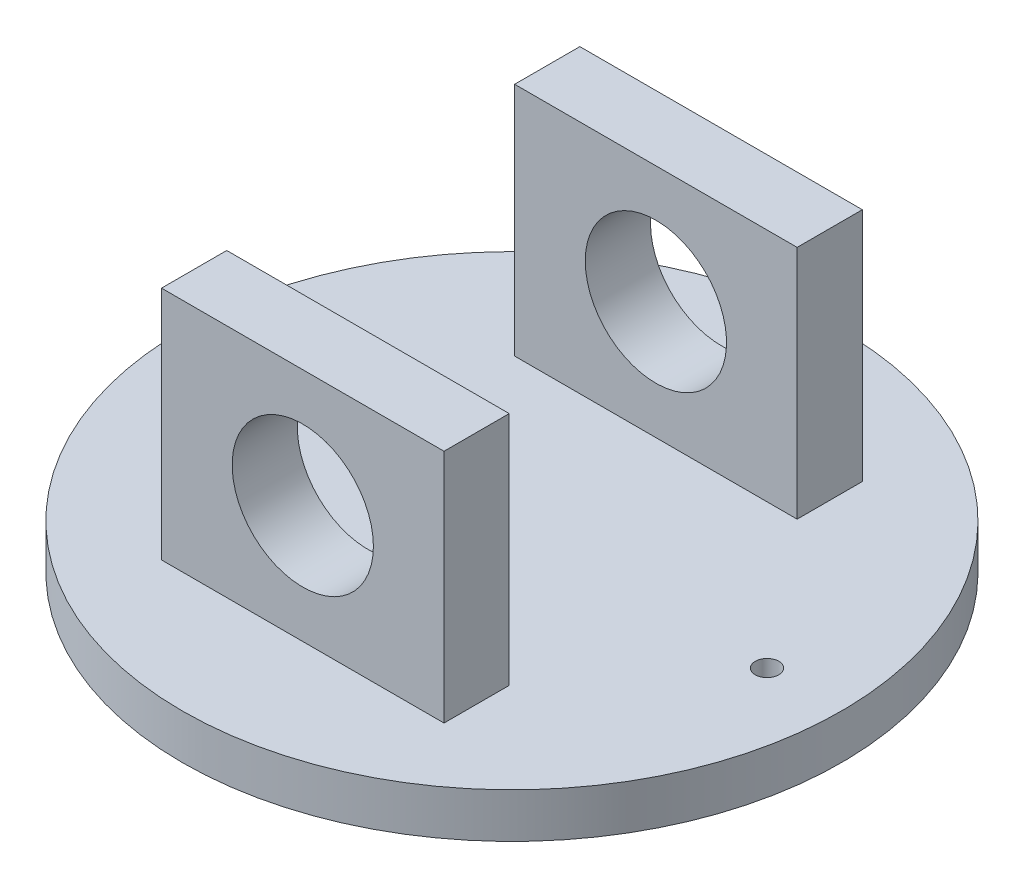
from build123d import *

# Parameters (mm, degrees)
SKETCH_4_R          = 2.5
EXTRUDE_3_DEPTH     = 25
SKETCH_5_R          = 7.5
EXTRUDE_4_DEPTH     = 25
SKETCH_6_R          = 139.999706489
EXTRUDE_5_DEPTH     = 19
SKETCH_15_W         = 120
SKETCH_15_H         = 27.7
EXTRUDE_7_DEPTH     = 100
CUT_EXTRUDE_3_REACH = 309.363
SKETCH_16_R         = 30
CUT_EXTRUDE_4_REACH = 309.363
SKETCH_17_R         = 30
SKETCH_18_R         = 2
EXTRUDE_8_DEPTH     = 30
SKETCH_19_R         = 5
CUT_EXTRUDE_5_DEPTH = 222.810359618


with BuildPart() as part:
    # 草图4 → 凸台-拉伸3 (new body)
    with BuildSketch(Plane(origin=(0, 0, 0), x_dir=(1, 0, 0), z_dir=(0, 1, 0))):
        with Locations(Location((0, 0, 0), (0, 0, 270))):
            Circle(SKETCH_4_R)
    extrude(amount=EXTRUDE_3_DEPTH)

    # 草图5 → 凸台-拉伸4 (add)
    with BuildSketch(Plane(origin=(0, 25, 0), x_dir=(1, 0, 0), z_dir=(0, 1, 0))):
        with Locations(Location((0, 0, 0), (0, 0, 270))):
            Circle(SKETCH_5_R)
    extrude(amount=EXTRUDE_4_DEPTH)

    # 草图6 → 凸台-拉伸5 (add)
    with BuildSketch(Plane(origin=(0, 50, 0), x_dir=(1, 0, 0), z_dir=(0, 1, 0))):
        with Locations(Location((0, 0, 0), (0, 0, 270))):
            Circle(SKETCH_6_R)
    extrude(amount=-EXTRUDE_5_DEPTH)

    # 草图15 → 凸台-拉伸7 (add)
    with BuildSketch(Plane(origin=(0, 50, 0), x_dir=(1, 0, 0), z_dir=(0, 1, 0))):
        with Locations((0, 75)):
            Rectangle(SKETCH_15_W, SKETCH_15_H)
        with Locations((0, -75)):
            Rectangle(SKETCH_15_W, SKETCH_15_H)
    extrude(amount=EXTRUDE_7_DEPTH)

    # 草图16 → 切除-拉伸3 (cut, up to next)
    with BuildSketch(Plane.XY.offset(88.85), mode=Mode.PRIVATE) as cut_extrude_3_sk1:
        with Locations((0, 100)):
            Circle(SKETCH_16_R)
    cut_extrude_3_tool1 = extrude(cut_extrude_3_sk1.sketch, amount=-CUT_EXTRUDE_3_REACH, mode=Mode.PRIVATE) & part.part
    add(cut_extrude_3_tool1.solids().sort_by_distance((0, 100, 88.85))[0], mode=Mode.SUBTRACT)

    # 草图17 → 切除-拉伸4 (cut, up to next)
    with BuildSketch(Plane(origin=(0, 0, -88.85), x_dir=(-1, 0, 0), z_dir=(0, 0, -1)), mode=Mode.PRIVATE) as cut_extrude_4_sk1:
        with Locations(Location((0, 100, 0), (0, 0, 180))):
            Circle(SKETCH_17_R)
    cut_extrude_4_tool1 = extrude(cut_extrude_4_sk1.sketch, amount=-CUT_EXTRUDE_4_REACH, mode=Mode.PRIVATE) & part.part
    add(cut_extrude_4_tool1.solids().sort_by_distance((0, 100, -88.85))[0], mode=Mode.SUBTRACT)

    # 草图18 → 凸台-拉伸8 (add)
    with BuildSketch(Plane.XZ.offset(-31)):
        with Locations(Location((0, 17.25, 0), (0, 0, 90))):
            Circle(SKETCH_18_R)
        with Locations(Location((14.938938215, 8.625, 0), (0, 0, 90))):
            Circle(SKETCH_18_R)
        with Locations(Location((14.938938215, -8.625, 0), (0, 0, 90))):
            Circle(SKETCH_18_R)
        with Locations(Location((0, -17.25, 0), (0, 0, 90))):
            Circle(SKETCH_18_R)
        with Locations(Location((-14.938938215, -8.625, 0), (0, 0, 90))):
            Circle(SKETCH_18_R)
        with Locations(Location((-14.938938215, 8.625, 0), (0, 0, 90))):
            Circle(SKETCH_18_R)
    extrude(amount=EXTRUDE_8_DEPTH)

    # 草图19 → 切除-拉伸5 (cut, symmetric)
    with BuildSketch(Plane(origin=(0, 50, 0), x_dir=(1, 0, 0), z_dir=(0, 1, 0))):
        with Locations(Location((108.378245134, 0, 0), (0, 0, 270))):
            Circle(SKETCH_19_R)
    cut_extrude_5 = extrude(amount=CUT_EXTRUDE_5_DEPTH, both=True, mode=Mode.SUBTRACT)

    # 镜向1: 切除-拉伸5 across plane
    add(cut_extrude_5.mirror(Plane(origin=(0, 0, 0), x_dir=(0, 0, 1), z_dir=(1, 0, 0))), mode=Mode.SUBTRACT)


solid = part.part
